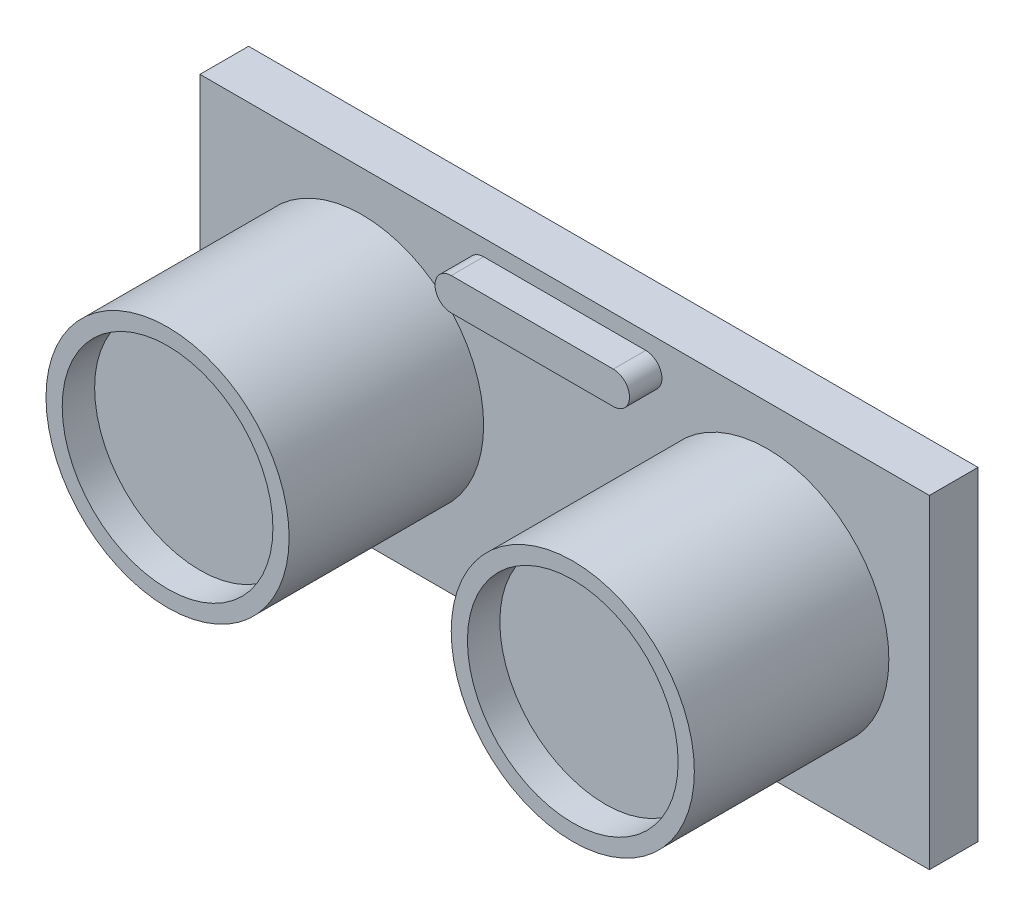
from build123d import *

# Parameters (mm, degrees)
SKETCH1_W           = 45
SKETCH1_H           = 20
BOSS_EXTRUDE1_DEPTH = 3
SKETCH2_R           = 7.5
SKETCH2_R_2         = 6.5
BOSS_EXTRUDE2_DEPTH = 12
SKETCH2_2_R         = 6.5
BOSS_EXTRUDE3_DEPTH = 10
BOSS_EXTRUDE4_DEPTH = 2


with BuildPart() as part:
    # Sketch1 → Boss-Extrude1 (new body)
    with BuildSketch(Plane.XY):
        with Locations((22.5, 10)):
            Rectangle(SKETCH1_W, SKETCH1_H)
    extrude(amount=BOSS_EXTRUDE1_DEPTH)

    # Sketch2 → Boss-Extrude2 (add)
    # profile 1 of 2: a face of its own
    with BuildSketch(Plane.XY.offset(3)):
        with Locations((10, 10)):
            Circle(SKETCH2_R)
        with Locations((10, 10)):
            Circle(SKETCH2_R_2, mode=Mode.SUBTRACT)
    # profile 2 of 2: a face of its own
    with BuildSketch(Plane.XY.offset(3)):
        with Locations((35, 10)):
            Circle(SKETCH2_R)
        with Locations((35, 10)):
            Circle(SKETCH2_R_2, mode=Mode.SUBTRACT)
    extrude(amount=BOSS_EXTRUDE2_DEPTH)

    # Sketch2<2> → Boss-Extrude3 (add)
    with BuildSketch(Plane.XY.offset(3)):
        with Locations((10, 10)):
            Circle(SKETCH2_2_R)
        with Locations((35, 10)):
            Circle(SKETCH2_2_R)
    extrude(amount=BOSS_EXTRUDE3_DEPTH)

    # Sketch3 → Boss-Extrude4 (add)
    with BuildSketch(Plane.XY.offset(3)):
        with BuildLine():
            Line((17.5, 19), (27.5, 19))
            ThreePointArc((27.5, 19), (28.5, 18), (27.5, 17))
            Line((27.5, 17), (17.5, 17))
            ThreePointArc((17.5, 17), (16.5, 18), (17.5, 19))
        make_face()
    extrude(amount=BOSS_EXTRUDE4_DEPTH)


solid = part.part
